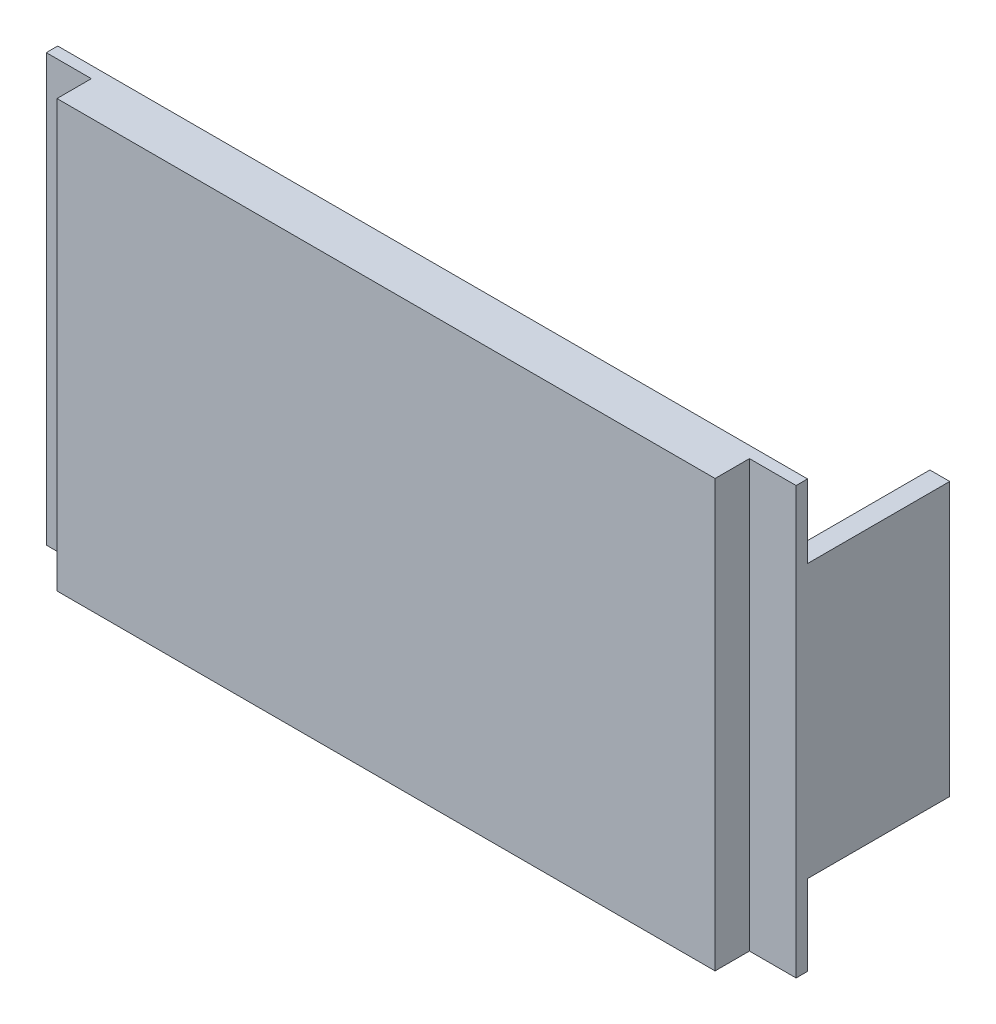
from build123d import *

# Parameters (mm, degrees)
SKETCH1_W           = 98.1
SKETCH1_H           = 55.8
BOSS_EXTRUDE1_DEPTH = 6
SKETCH2_W           = 5.9
SKETCH2_H           = 55.8
SKETCH2_W_2         = 6.1
CUT_EXTRUDE1_DEPTH  = 4.5
SKETCH3_W           = 14.8
SKETCH3_H           = 14.7
BOSS_EXTRUDE4_DEPTH = 4.1
SKETCH4_W           = 2.6
SKETCH4_H           = 35.7
BOSS_EXTRUDE5_DEPTH = 18.6
SKETCH5_W           = 14.8
SKETCH5_H           = 14.7
BOSS_EXTRUDE6_DEPTH = 2.2


with BuildPart() as part:
    # Sketch1 → Boss-Extrude1 (new body)
    with BuildSketch(Plane.XY):
        with Locations((0, -1.56102071)):
            Rectangle(SKETCH1_W, SKETCH1_H)
    extrude(amount=BOSS_EXTRUDE1_DEPTH)

    # Sketch2 → Cut-Extrude1 (cut)
    with BuildSketch(Plane.XY.offset(6)):
        with Locations((-46.1, -1.56102071)):
            Rectangle(SKETCH2_W, SKETCH2_H)
        with Locations((46, -1.56102071)):
            Rectangle(SKETCH2_W_2, SKETCH2_H)
    extrude(amount=-CUT_EXTRUDE1_DEPTH, mode=Mode.SUBTRACT)

    # Sketch3 → Boss-Extrude4 (add)
    with BuildSketch(Plane.XY.offset(6)):
        with Locations((-1.877850501, -21.022317242)):
            Rectangle(SKETCH3_W, SKETCH3_H)
    extrude(amount=-BOSS_EXTRUDE4_DEPTH)

    # Sketch4 → Boss-Extrude5 (add)
    with BuildSketch(Plane(origin=(0, 0, 0), x_dir=(-1, 0, 0), z_dir=(0, 0, -1))):
        with Locations((-47.75, -1.098812698)):
            Rectangle(SKETCH4_W, SKETCH4_H)
    extrude(amount=BOSS_EXTRUDE5_DEPTH)

    # Sketch5 → Boss-Extrude6 (add)
    with BuildSketch(Plane(origin=(0, 0, 0), x_dir=(-1, 0, 0), z_dir=(0, 0, -1))):
        with Locations((2.55, -20.51102071)):
            Rectangle(SKETCH5_W, SKETCH5_H)
    extrude(amount=BOSS_EXTRUDE6_DEPTH)


solid = part.part
